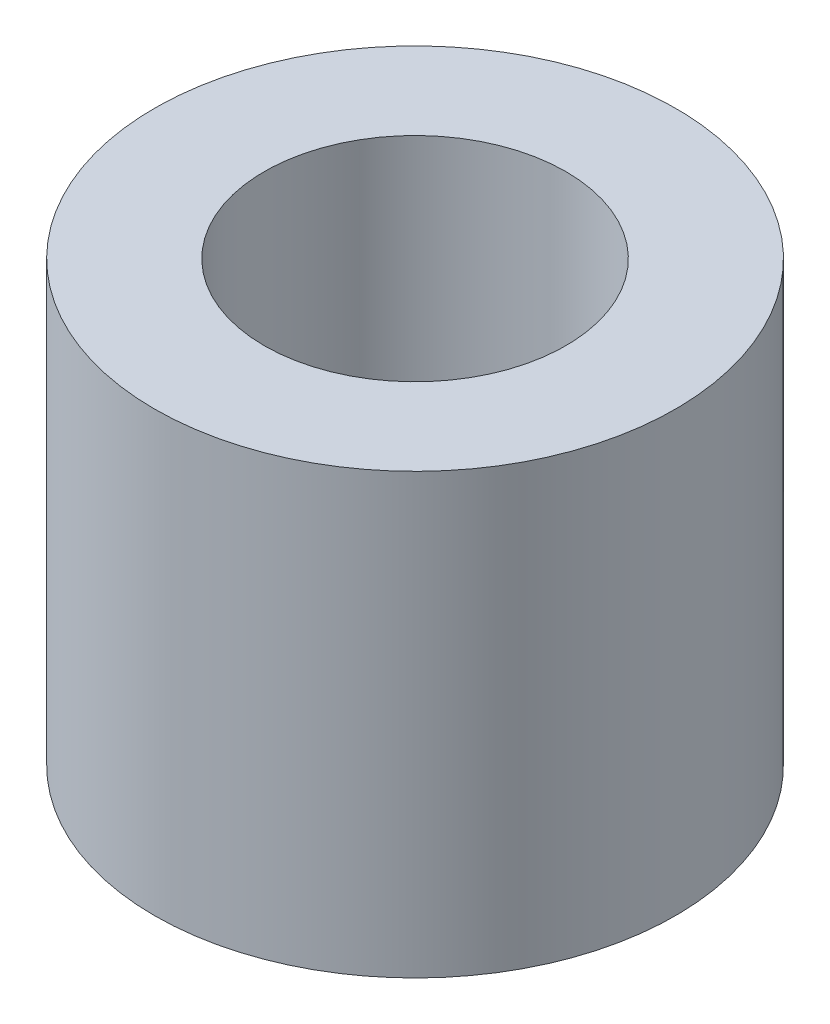
from build123d import *

# Parameters (mm, degrees)
CROQUIS1_R              = 9.5
SALIENTE_EXTRUIR1_DEPTH = 16
CORTAR_EXTRUIR1_REACH   = 22.893
CROQUIS2_R              = 5.5


with BuildPart() as part:
    # Croquis1 → Saliente-Extruir1 (new body)
    with BuildSketch(Plane(origin=(0, 0, 0), x_dir=(1, 0, 0), z_dir=(0, 1, 0))):
        with Locations(Location((0, 0, 0), (0, 0, 270))):
            Circle(CROQUIS1_R)
    extrude(amount=SALIENTE_EXTRUIR1_DEPTH)

    # Croquis2 → Cortar-Extruir1 (cut, up to next)
    with BuildSketch(Plane(origin=(0, 16, 0), x_dir=(1, 0, 0), z_dir=(0, 1, 0)), mode=Mode.PRIVATE) as cortar_extruir1_sk1:
        with Locations(Location((0, 0, 0), (0, 0, 270))):
            Circle(CROQUIS2_R)
    cortar_extruir1_tool1 = extrude(cortar_extruir1_sk1.sketch, amount=-CORTAR_EXTRUIR1_REACH, mode=Mode.PRIVATE) & part.part
    add(cortar_extruir1_tool1.solids().sort_by_distance((0, 16, 0))[0], mode=Mode.SUBTRACT)


solid = part.part
